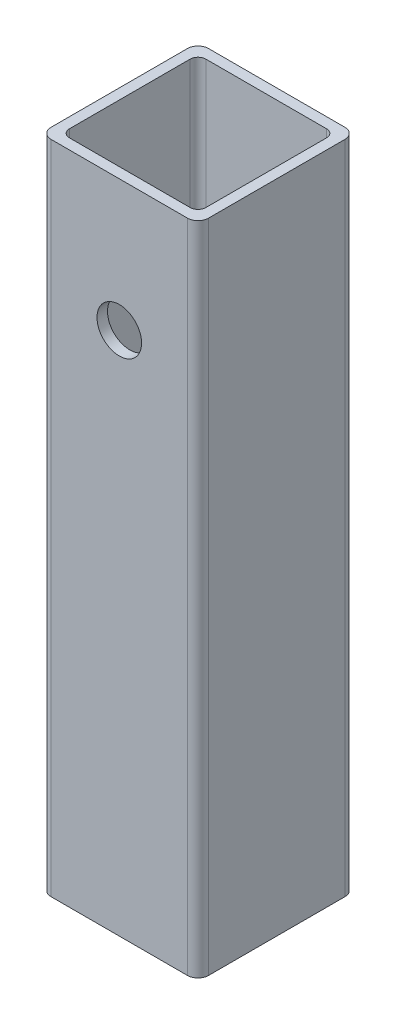
from build123d import *

# Parameters (mm, degrees)
EXTRUDE_1_DEPTH      = 100
EXTRUDE_1_DEPTH_BACK = 150
SKETCH_2_R           = 8.5
CUT_EXTRUDE_1_DEPTH  = 173.336879396


with BuildPart() as part:
    # Эскиз1 → Бобышка-Вытянуть1 (new, two sides: drawn at the far end of the back side and taken through both)
    with BuildSketch(Plane(origin=(0, 0, 0), x_dir=(1, 0, 0), z_dir=(0, 1, 0)).offset(-EXTRUDE_1_DEPTH_BACK)):
        with BuildLine():
            Line((-56, 0), (-4, 0))
            ThreePointArc((-4, 0), (-1.171572875, -1.171572875), (0, -4))
            Line((0, -4), (0, -56))
            ThreePointArc((0, -56), (-1.171572875, -58.828427125), (-4, -60))
            Line((-4, -60), (-56, -60))
            ThreePointArc((-56, -60), (-58.828427125, -58.828427125), (-60, -56))
            Line((-60, -56), (-60, -4))
            ThreePointArc((-60, -4), (-58.828427125, -1.171572875), (-56, 0))
        make_face()
        with BuildLine():
            Line((-53, -4), (-7, -4))
            ThreePointArc((-7, -4), (-4.878679656, -4.878679656), (-4, -7))
            Line((-4, -7), (-4, -53))
            ThreePointArc((-4, -53), (-4.878679656, -55.121320344), (-7, -56))
            Line((-7, -56), (-53, -56))
            ThreePointArc((-53, -56), (-55.121320344, -55.121320344), (-56, -53))
            Line((-56, -53), (-56, -7))
            ThreePointArc((-56, -7), (-55.121320344, -4.878679656), (-53, -4))
        make_face(mode=Mode.SUBTRACT)
    extrude(amount=EXTRUDE_1_DEPTH + EXTRUDE_1_DEPTH_BACK)

    # Эскиз2 → Вырез-Вытянуть1 (cut, through all)
    with BuildSketch(Plane.XY.offset(60)):
        with Locations((-30, 50)):
            Circle(SKETCH_2_R)
    extrude(amount=-CUT_EXTRUDE_1_DEPTH, mode=Mode.SUBTRACT)


solid = part.part
